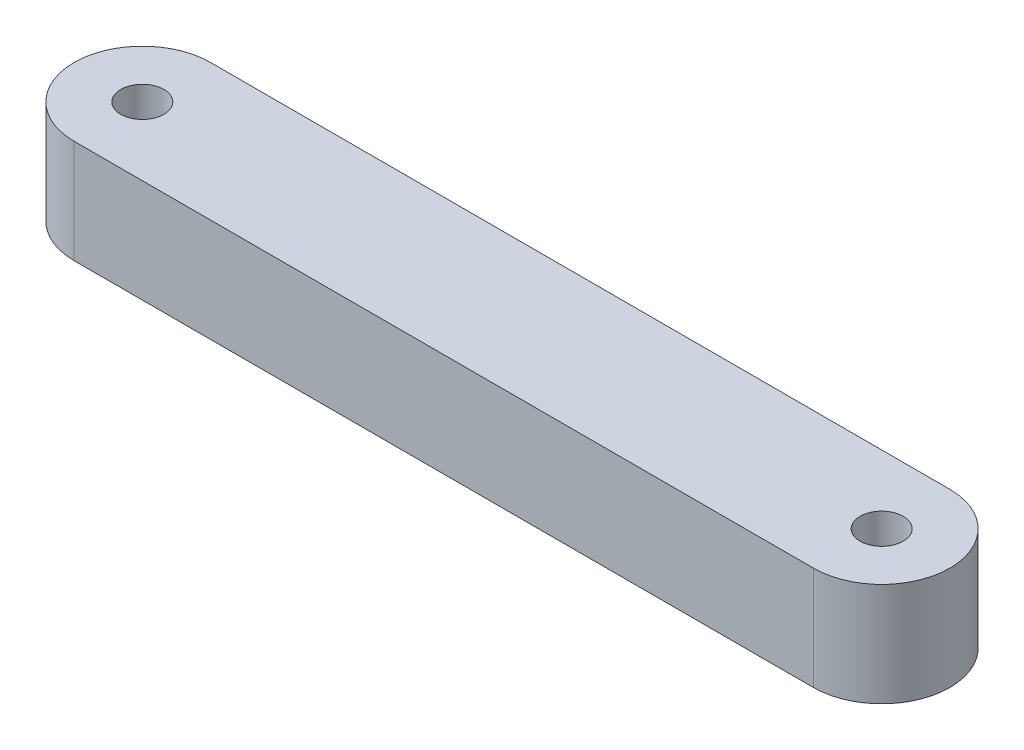
from build123d import *

# Parameters (mm, degrees)
SKETCH1_R           = 2.65
BOSS_EXTRUDE1_DEPTH = 12.7


with BuildPart() as part:
    # Sketch1 → Boss-Extrude1 (new body)
    with BuildSketch(Plane(origin=(0, 0, 0), x_dir=(1, 0, 0), z_dir=(0, 1, 0))):
        with BuildLine():
            Line((0, 8.382), (90.805, 8.382))
            ThreePointArc((90.805, 8.382), (99.187, 0), (90.805, -8.382))
            Line((90.805, -8.382), (0, -8.382))
            ThreePointArc((0, -8.382), (-8.382, 0), (0, 8.382))
        make_face()
        with Locations(Location((0, 0, 0), (0, 0, 270))):
            Circle(SKETCH1_R, mode=Mode.SUBTRACT)
        with Locations(Location((90.805, 0, 0), (0, 0, 270))):
            Circle(SKETCH1_R, mode=Mode.SUBTRACT)
    extrude(amount=BOSS_EXTRUDE1_DEPTH)


solid = part.part
